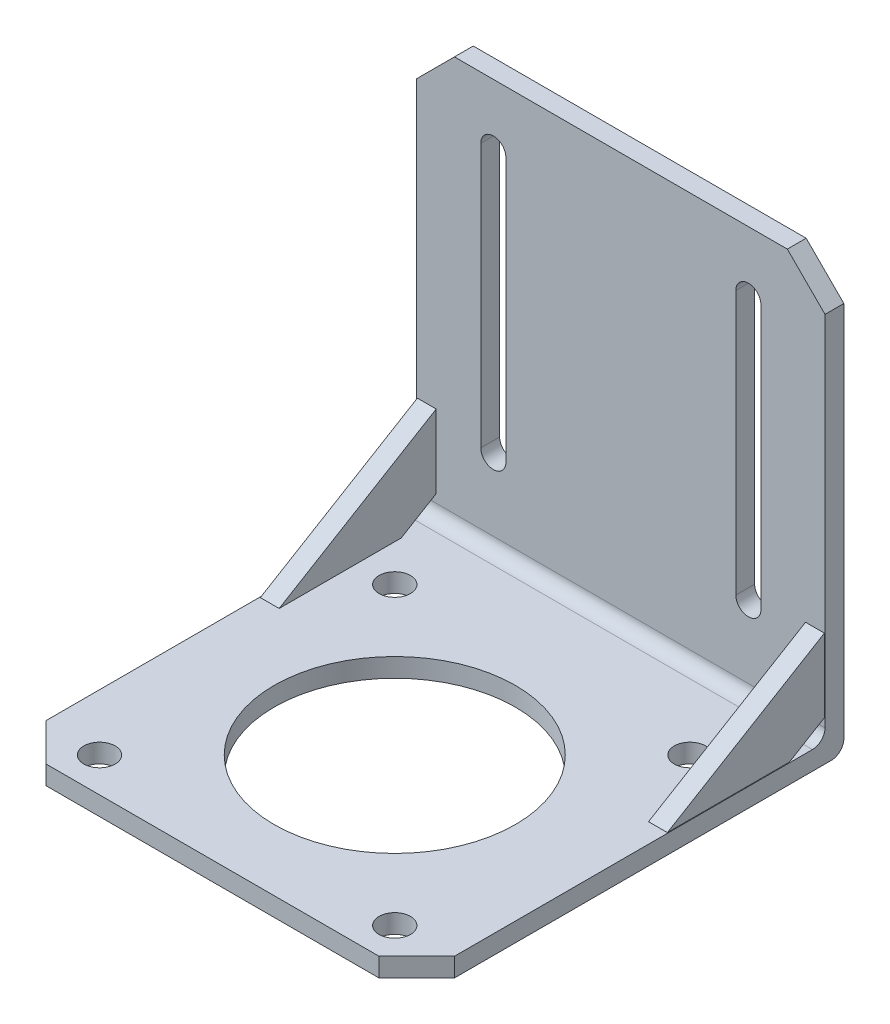
from build123d import *

# Parameters (mm, degrees)
SKETCH1_W           = 65
SKETCH1_H           = 65
BOSS_EXTRUDE1_DEPTH = 3
SKETCH2_W           = 65
SKETCH2_H           = 3
BOSS_EXTRUDE2_DEPTH = 68
SKETCH4_R           = 19.2
CUT_EXTRUDE1_DEPTH  = 100.525122457
SKETCH5_R           = 2.5
CUT_EXTRUDE2_DEPTH  = 100.525122457
CUT_EXTRUDE3_DEPTH  = 100.525122457
BOSS_EXTRUDE3_START = -0.1
BOSS_EXTRUDE3_DEPTH = 3
BOSS_EXTRUDE4_START = -0.1
BOSS_EXTRUDE4_DEPTH = 3
FILLET1_R           = 2
CHAMFER1_SIZE       = 6


with BuildPart() as part:
    # Sketch1 → Boss-Extrude1 (new body)
    with BuildSketch(Plane(origin=(0, 0, 0), x_dir=(1, 0, 0), z_dir=(0, 1, 0))):
        with Locations((0, 32.5)):
            Rectangle(SKETCH1_W, SKETCH1_H)
    extrude(amount=BOSS_EXTRUDE1_DEPTH)

    # Sketch2 → Boss-Extrude2 (add)
    with BuildSketch(Plane.XZ):
        with Locations((0, -66.5)):
            Rectangle(SKETCH2_W, SKETCH2_H)
    extrude(amount=-BOSS_EXTRUDE2_DEPTH)

    # Sketch4 → Cut-Extrude1 (cut, through all)
    with BuildSketch(Plane(origin=(0, 3, 0), x_dir=(1, 0, 0), z_dir=(0, 1, 0))):
        with Locations(Location((0, 29, 0), (0, 0, 270))):
            Circle(SKETCH4_R)
    extrude(amount=-CUT_EXTRUDE1_DEPTH, mode=Mode.SUBTRACT)

    # Sketch5 → Cut-Extrude2 (cut, through all)
    with BuildSketch(Plane(origin=(0, 3, 0), x_dir=(1, 0, 0), z_dir=(0, 1, 0))):
        with Locations(Location((-23.5, 52.5, 0), (0, 0, 270))):
            Circle(SKETCH5_R)
        with Locations(Location((23.5, 52.5, 0), (0, 0, 270))):
            Circle(SKETCH5_R)
        with Locations(Location((23.5, 5.5, 0), (0, 0, 270))):
            Circle(SKETCH5_R)
        with Locations(Location((-23.5, 5.5, 0), (0, 0, 270))):
            Circle(SKETCH5_R)
    extrude(amount=-CUT_EXTRUDE2_DEPTH, mode=Mode.SUBTRACT)

    # Sketch6 → Cut-Extrude3 (cut, through all)
    with BuildSketch(Plane.XY.offset(-65)):
        with BuildLine():
            Line((-18.3, 58.2), (-18.3, 16.2))
            ThreePointArc((-18.3, 16.2), (-20.3, 14.2), (-22.3, 16.2))
            Line((-22.3, 16.2), (-22.3, 58.2))
            ThreePointArc((-22.3, 58.2), (-20.3, 60.2), (-18.3, 58.2))
        make_face()
        with BuildLine():
            Line((18.3, 58.2), (18.3, 16.2))
            ThreePointArc((18.3, 16.2), (20.3, 14.2), (22.3, 16.2))
            Line((22.3, 16.2), (22.3, 58.2))
            ThreePointArc((22.3, 58.2), (20.3, 60.2), (18.3, 58.2))
        make_face()
    extrude(amount=-CUT_EXTRUDE3_DEPTH, mode=Mode.SUBTRACT)

    # Sketch8 → Boss-Extrude3 (add)
    with BuildSketch(Plane.ZY.offset(32.5).offset(BOSS_EXTRUDE3_START)):
        Polygon((-40, 3), (-65, 18), (-65, 6.33809621), (-59.436506316, 3), align=None)
    extrude(amount=-BOSS_EXTRUDE3_DEPTH)

    # Sketch9 → Boss-Extrude4 (add)
    with BuildSketch(Plane(origin=(32.5, 0, 0), x_dir=(0, 0, -1), z_dir=(1, 0, 0)).offset(BOSS_EXTRUDE4_START)):
        Polygon((40, 3), (59.436506316, 3), (65, 6.33809621), (65, 18), align=None)
    extrude(amount=-BOSS_EXTRUDE4_DEPTH)

    # Fillet1
    fillet1_edges = [part.edges().sort_by_distance(p)[0] for p in [
        (0, 3, -65),
        (0, 0, -68),
    ]]
    fillet(fillet1_edges, radius=FILLET1_R)

    # Chamfer1
    chamfer1_edges = [part.edges().sort_by_distance(p)[0] for p in [
        (-32.5, 68, -66.5),
        (32.5, 68, -66.5),
        (32.5, 1.5, 0),
        (-32.5, 1.5, 0),
    ]]
    chamfer(chamfer1_edges, length=CHAMFER1_SIZE)


solid = part.part
